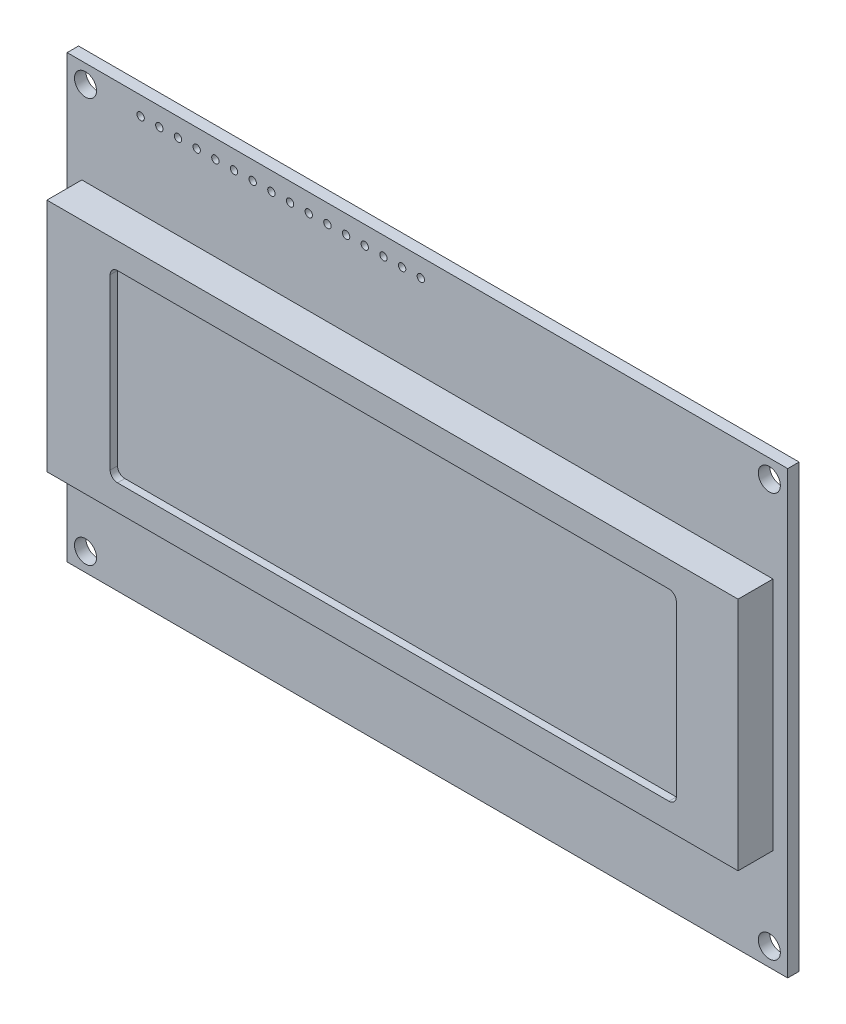
from build123d import *

# Parameters (mm, degrees)
ESQUISSE1_W             = 98
ESQUISSE1_H             = 60
ESQUISSE1_R             = 1.5
ESQUISSE1_R_2           = 0.5
BOSS_EXTRU_1_DEPTH      = 1.55
ESQUISSE2_W             = 94
ESQUISSE2_H             = 32
BOSS_EXTRU_2_DEPTH      = 4.75
ENL_V_MAT_EXTRU_2_DEPTH = 1


with BuildPart() as part:
    # Esquisse1 → Boss.-Extru.1 (new body)
    with BuildSketch(Plane.XY):
        with Locations((-13.900836029, 1.990498339)):
            Rectangle(ESQUISSE1_W, ESQUISSE1_H)
        with Locations(Location((-60.400836029, 29.490498339, 0), (0, 0, 180))):
            Circle(ESQUISSE1_R, mode=Mode.SUBTRACT)
        with Locations(Location((32.599163971, 29.490498339, 0), (0, 0, 180))):
            Circle(ESQUISSE1_R, mode=Mode.SUBTRACT)
        with Locations(Location((32.599163971, -25.509501661, 0), (0, 0, 180))):
            Circle(ESQUISSE1_R, mode=Mode.SUBTRACT)
        with Locations(Location((-60.400836029, -25.509501661, 0), (0, 0, 180))):
            Circle(ESQUISSE1_R, mode=Mode.SUBTRACT)
        with Locations((-52.900836029, 29.490498339)):
            Circle(ESQUISSE1_R_2, mode=Mode.SUBTRACT)
        with Locations((-50.360836029, 29.490498339)):
            Circle(ESQUISSE1_R_2, mode=Mode.SUBTRACT)
        with Locations((-47.820836029, 29.490498339)):
            Circle(ESQUISSE1_R_2, mode=Mode.SUBTRACT)
        with Locations((-45.280836029, 29.490498339)):
            Circle(ESQUISSE1_R_2, mode=Mode.SUBTRACT)
        with Locations((-42.740836029, 29.490498339)):
            Circle(ESQUISSE1_R_2, mode=Mode.SUBTRACT)
        with Locations((-40.200836029, 29.490498339)):
            Circle(ESQUISSE1_R_2, mode=Mode.SUBTRACT)
        with Locations((-37.660836029, 29.490498339)):
            Circle(ESQUISSE1_R_2, mode=Mode.SUBTRACT)
        with Locations((-35.120836029, 29.490498339)):
            Circle(ESQUISSE1_R_2, mode=Mode.SUBTRACT)
        with Locations((-32.580836029, 29.490498339)):
            Circle(ESQUISSE1_R_2, mode=Mode.SUBTRACT)
        with Locations((-30.040836029, 29.490498339)):
            Circle(ESQUISSE1_R_2, mode=Mode.SUBTRACT)
        with Locations((-27.500836029, 29.490498339)):
            Circle(ESQUISSE1_R_2, mode=Mode.SUBTRACT)
        with Locations((-24.960836029, 29.490498339)):
            Circle(ESQUISSE1_R_2, mode=Mode.SUBTRACT)
        with Locations((-22.420836029, 29.490498339)):
            Circle(ESQUISSE1_R_2, mode=Mode.SUBTRACT)
        with Locations((-19.880836029, 29.490498339)):
            Circle(ESQUISSE1_R_2, mode=Mode.SUBTRACT)
        with Locations((-17.340836029, 29.490498339)):
            Circle(ESQUISSE1_R_2, mode=Mode.SUBTRACT)
        with Locations((-14.800836029, 29.490498339)):
            Circle(ESQUISSE1_R_2, mode=Mode.SUBTRACT)
    extrude(amount=BOSS_EXTRU_1_DEPTH)

    # Esquisse2 → Boss.-Extru.2 (add)
    with BuildSketch(Plane.XY.offset(1.55)):
        with Locations((-13.900836029, 1.990498339)):
            Rectangle(ESQUISSE2_W, ESQUISSE2_H)
    extrude(amount=BOSS_EXTRU_2_DEPTH)

    # Esquisse5 → Enlèv. mat.-Extru.2 (cut)
    with BuildSketch(Plane.XY.offset(6.3)):
        with BuildLine():
            Line((-51.300836029, 14.490498339), (23.699163971, 14.490498339))
            ThreePointArc((23.699163971, 14.490498339), (24.406270752, 14.19760512), (24.699163971, 13.490498339))
            Line((24.699163971, 13.490498339), (24.699163971, -9.509501661))
            ThreePointArc((24.699163971, -9.509501661), (24.406270752, -10.216608442), (23.699163971, -10.509501661))
            Line((23.699163971, -10.509501661), (-51.300836029, -10.509501661))
            ThreePointArc((-51.300836029, -10.509501661), (-52.00794281, -10.216608442), (-52.300836029, -9.509501661))
            Line((-52.300836029, -9.509501661), (-52.300836029, 13.490498339))
            ThreePointArc((-52.300836029, 13.490498339), (-52.00794281, 14.19760512), (-51.300836029, 14.490498339))
        make_face()
    extrude(amount=-ENL_V_MAT_EXTRU_2_DEPTH, mode=Mode.SUBTRACT)


solid = part.part
